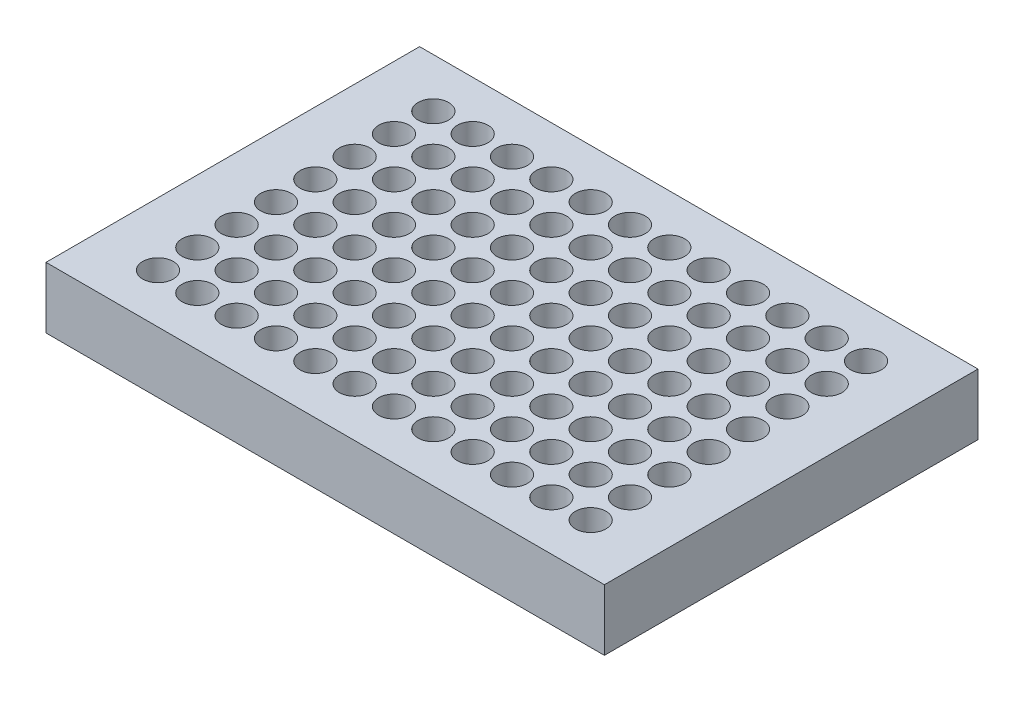
from build123d import *

# Parameters (mm, degrees)
SKETCH1_W           = 127.76
SKETCH1_H           = 85.48
BOSS_EXTRUDE1_DEPTH = 14
SKETCH6_R           = 3.5
CUT_EXTRUDE1_DEPTH  = 8


with BuildPart() as part:
    # Sketch1 → Boss-Extrude1 (new body)
    with BuildSketch(Plane(origin=(0, 0, 0), x_dir=(1, 0, 0), z_dir=(0, 1, 0))):
        with Locations((63.88, 42.74)):
            Rectangle(SKETCH1_W, SKETCH1_H)
    extrude(amount=BOSS_EXTRUDE1_DEPTH)

    # Sketch6 → Cut-Extrude1 (cut)
    with BuildSketch(Plane(origin=(0, 14, 0), x_dir=(1, 0, 0), z_dir=(0, 1, 0))):
        with Locations(Location((59.38, 47.24, 0), (0, 0, 270))):
            Circle(SKETCH6_R)
        with Locations(Location((14.38, 38.24, 0), (0, 0, 90))):
            Circle(SKETCH6_R)
        with Locations(Location((23.38, 38.24, 0), (0, 0, 90))):
            Circle(SKETCH6_R)
        with Locations(Location((32.38, 38.24, 0), (0, 0, 90))):
            Circle(SKETCH6_R)
        with Locations(Location((50.38, 47.24, 0), (0, 0, 270))):
            Circle(SKETCH6_R)
        with Locations(Location((41.38, 47.24, 0), (0, 0, 270))):
            Circle(SKETCH6_R)
        with Locations(Location((32.38, 47.24, 0), (0, 0, 270))):
            Circle(SKETCH6_R)
        with Locations(Location((23.38, 47.24, 0), (0, 0, 270))):
            Circle(SKETCH6_R)
        with Locations(Location((14.38, 47.24, 0), (0, 0, 270))):
            Circle(SKETCH6_R)
        with Locations(Location((41.38, 38.24, 0), (0, 0, 90))):
            Circle(SKETCH6_R)
        with Locations(Location((50.38, 38.24, 0), (0, 0, 90))):
            Circle(SKETCH6_R)
        with Locations(Location((59.38, 38.24, 0), (0, 0, 90))):
            Circle(SKETCH6_R)
        with Locations(Location((68.38, 38.24, 0), (0, 0, 270))):
            Circle(SKETCH6_R)
        with Locations(Location((77.38, 38.24, 0), (0, 0, 270))):
            Circle(SKETCH6_R)
        with Locations(Location((86.38, 38.24, 0), (0, 0, 270))):
            Circle(SKETCH6_R)
        with Locations(Location((113.38, 47.24, 0), (0, 0, 90))):
            Circle(SKETCH6_R)
        with Locations(Location((104.38, 47.24, 0), (0, 0, 90))):
            Circle(SKETCH6_R)
        with Locations(Location((95.38, 47.24, 0), (0, 0, 90))):
            Circle(SKETCH6_R)
        with Locations(Location((86.38, 47.24, 0), (0, 0, 90))):
            Circle(SKETCH6_R)
        with Locations(Location((77.38, 47.24, 0), (0, 0, 90))):
            Circle(SKETCH6_R)
        with Locations(Location((95.38, 38.24, 0), (0, 0, 270))):
            Circle(SKETCH6_R)
        with Locations(Location((104.38, 38.24, 0), (0, 0, 270))):
            Circle(SKETCH6_R)
        with Locations(Location((113.38, 38.24, 0), (0, 0, 270))):
            Circle(SKETCH6_R)
        with Locations(Location((68.38, 47.24, 0), (0, 0, 90))):
            Circle(SKETCH6_R)
        with Locations(Location((59.38, 56.24, 0), (0, 0, 270))):
            Circle(SKETCH6_R)
        with Locations(Location((50.38, 56.24, 0), (0, 0, 270))):
            Circle(SKETCH6_R)
        with Locations(Location((41.38, 56.24, 0), (0, 0, 270))):
            Circle(SKETCH6_R)
        with Locations(Location((32.38, 56.24, 0), (0, 0, 270))):
            Circle(SKETCH6_R)
        with Locations(Location((23.38, 56.24, 0), (0, 0, 270))):
            Circle(SKETCH6_R)
        with Locations(Location((14.38, 56.24, 0), (0, 0, 270))):
            Circle(SKETCH6_R)
        with Locations(Location((113.38, 56.24, 0), (0, 0, 90))):
            Circle(SKETCH6_R)
        with Locations(Location((104.38, 56.24, 0), (0, 0, 90))):
            Circle(SKETCH6_R)
        with Locations(Location((95.38, 56.24, 0), (0, 0, 90))):
            Circle(SKETCH6_R)
        with Locations(Location((86.38, 56.24, 0), (0, 0, 90))):
            Circle(SKETCH6_R)
        with Locations(Location((77.38, 56.24, 0), (0, 0, 90))):
            Circle(SKETCH6_R)
        with Locations(Location((68.38, 56.24, 0), (0, 0, 90))):
            Circle(SKETCH6_R)
        with Locations(Location((59.38, 65.24, 0), (0, 0, 270))):
            Circle(SKETCH6_R)
        with Locations(Location((50.38, 65.24, 0), (0, 0, 270))):
            Circle(SKETCH6_R)
        with Locations(Location((41.38, 65.24, 0), (0, 0, 270))):
            Circle(SKETCH6_R)
        with Locations(Location((32.38, 65.24, 0), (0, 0, 270))):
            Circle(SKETCH6_R)
        with Locations(Location((23.38, 65.24, 0), (0, 0, 270))):
            Circle(SKETCH6_R)
        with Locations(Location((14.38, 65.24, 0), (0, 0, 270))):
            Circle(SKETCH6_R)
        with Locations(Location((113.38, 65.24, 0), (0, 0, 90))):
            Circle(SKETCH6_R)
        with Locations(Location((104.38, 65.24, 0), (0, 0, 90))):
            Circle(SKETCH6_R)
        with Locations(Location((95.38, 65.24, 0), (0, 0, 90))):
            Circle(SKETCH6_R)
        with Locations(Location((86.38, 65.24, 0), (0, 0, 90))):
            Circle(SKETCH6_R)
        with Locations(Location((77.38, 65.24, 0), (0, 0, 90))):
            Circle(SKETCH6_R)
        with Locations(Location((68.38, 65.24, 0), (0, 0, 90))):
            Circle(SKETCH6_R)
        with Locations(Location((59.38, 74.24, 0), (0, 0, 270))):
            Circle(SKETCH6_R)
        with Locations(Location((50.38, 74.24, 0), (0, 0, 270))):
            Circle(SKETCH6_R)
        with Locations(Location((41.38, 74.24, 0), (0, 0, 270))):
            Circle(SKETCH6_R)
        with Locations(Location((32.38, 74.24, 0), (0, 0, 270))):
            Circle(SKETCH6_R)
        with Locations(Location((23.38, 74.24, 0), (0, 0, 270))):
            Circle(SKETCH6_R)
        with Locations(Location((14.38, 74.24, 0), (0, 0, 270))):
            Circle(SKETCH6_R)
        with Locations(Location((113.38, 74.24, 0), (0, 0, 90))):
            Circle(SKETCH6_R)
        with Locations(Location((104.38, 74.24, 0), (0, 0, 90))):
            Circle(SKETCH6_R)
        with Locations(Location((95.38, 74.24, 0), (0, 0, 90))):
            Circle(SKETCH6_R)
        with Locations(Location((86.38, 74.24, 0), (0, 0, 90))):
            Circle(SKETCH6_R)
        with Locations(Location((77.38, 74.24, 0), (0, 0, 90))):
            Circle(SKETCH6_R)
        with Locations(Location((68.38, 74.24, 0), (0, 0, 90))):
            Circle(SKETCH6_R)
        with Locations(Location((14.38, 29.24, 0), (0, 0, 90))):
            Circle(SKETCH6_R)
        with Locations(Location((23.38, 29.24, 0), (0, 0, 90))):
            Circle(SKETCH6_R)
        with Locations(Location((32.38, 29.24, 0), (0, 0, 90))):
            Circle(SKETCH6_R)
        with Locations(Location((41.38, 29.24, 0), (0, 0, 90))):
            Circle(SKETCH6_R)
        with Locations(Location((50.38, 29.24, 0), (0, 0, 90))):
            Circle(SKETCH6_R)
        with Locations(Location((59.38, 29.24, 0), (0, 0, 90))):
            Circle(SKETCH6_R)
        with Locations(Location((68.38, 29.24, 0), (0, 0, 270))):
            Circle(SKETCH6_R)
        with Locations(Location((77.38, 29.24, 0), (0, 0, 270))):
            Circle(SKETCH6_R)
        with Locations(Location((86.38, 29.24, 0), (0, 0, 270))):
            Circle(SKETCH6_R)
        with Locations(Location((95.38, 29.24, 0), (0, 0, 270))):
            Circle(SKETCH6_R)
        with Locations(Location((104.38, 29.24, 0), (0, 0, 270))):
            Circle(SKETCH6_R)
        with Locations(Location((113.38, 29.24, 0), (0, 0, 270))):
            Circle(SKETCH6_R)
        with Locations(Location((14.38, 20.24, 0), (0, 0, 90))):
            Circle(SKETCH6_R)
        with Locations(Location((23.38, 20.24, 0), (0, 0, 90))):
            Circle(SKETCH6_R)
        with Locations(Location((32.38, 20.24, 0), (0, 0, 90))):
            Circle(SKETCH6_R)
        with Locations(Location((41.38, 20.24, 0), (0, 0, 90))):
            Circle(SKETCH6_R)
        with Locations(Location((50.38, 20.24, 0), (0, 0, 90))):
            Circle(SKETCH6_R)
        with Locations(Location((59.38, 20.24, 0), (0, 0, 90))):
            Circle(SKETCH6_R)
        with Locations(Location((68.38, 20.24, 0), (0, 0, 270))):
            Circle(SKETCH6_R)
        with Locations(Location((77.38, 20.24, 0), (0, 0, 270))):
            Circle(SKETCH6_R)
        with Locations(Location((86.38, 20.24, 0), (0, 0, 270))):
            Circle(SKETCH6_R)
        with Locations(Location((95.38, 20.24, 0), (0, 0, 270))):
            Circle(SKETCH6_R)
        with Locations(Location((104.38, 20.24, 0), (0, 0, 270))):
            Circle(SKETCH6_R)
        with Locations(Location((113.38, 20.24, 0), (0, 0, 270))):
            Circle(SKETCH6_R)
        with Locations(Location((14.38, 11.24, 0), (0, 0, 90))):
            Circle(SKETCH6_R)
        with Locations(Location((23.38, 11.24, 0), (0, 0, 90))):
            Circle(SKETCH6_R)
        with Locations(Location((32.38, 11.24, 0), (0, 0, 90))):
            Circle(SKETCH6_R)
        with Locations(Location((41.38, 11.24, 0), (0, 0, 90))):
            Circle(SKETCH6_R)
        with Locations(Location((50.38, 11.24, 0), (0, 0, 90))):
            Circle(SKETCH6_R)
        with Locations(Location((59.38, 11.24, 0), (0, 0, 90))):
            Circle(SKETCH6_R)
        with Locations(Location((68.38, 11.24, 0), (0, 0, 270))):
            Circle(SKETCH6_R)
        with Locations(Location((77.38, 11.24, 0), (0, 0, 270))):
            Circle(SKETCH6_R)
        with Locations(Location((86.38, 11.24, 0), (0, 0, 270))):
            Circle(SKETCH6_R)
        with Locations(Location((95.38, 11.24, 0), (0, 0, 270))):
            Circle(SKETCH6_R)
        with Locations(Location((104.38, 11.24, 0), (0, 0, 270))):
            Circle(SKETCH6_R)
        with Locations(Location((113.38, 11.24, 0), (0, 0, 270))):
            Circle(SKETCH6_R)
    extrude(amount=-CUT_EXTRUDE1_DEPTH, mode=Mode.SUBTRACT)


solid = part.part
